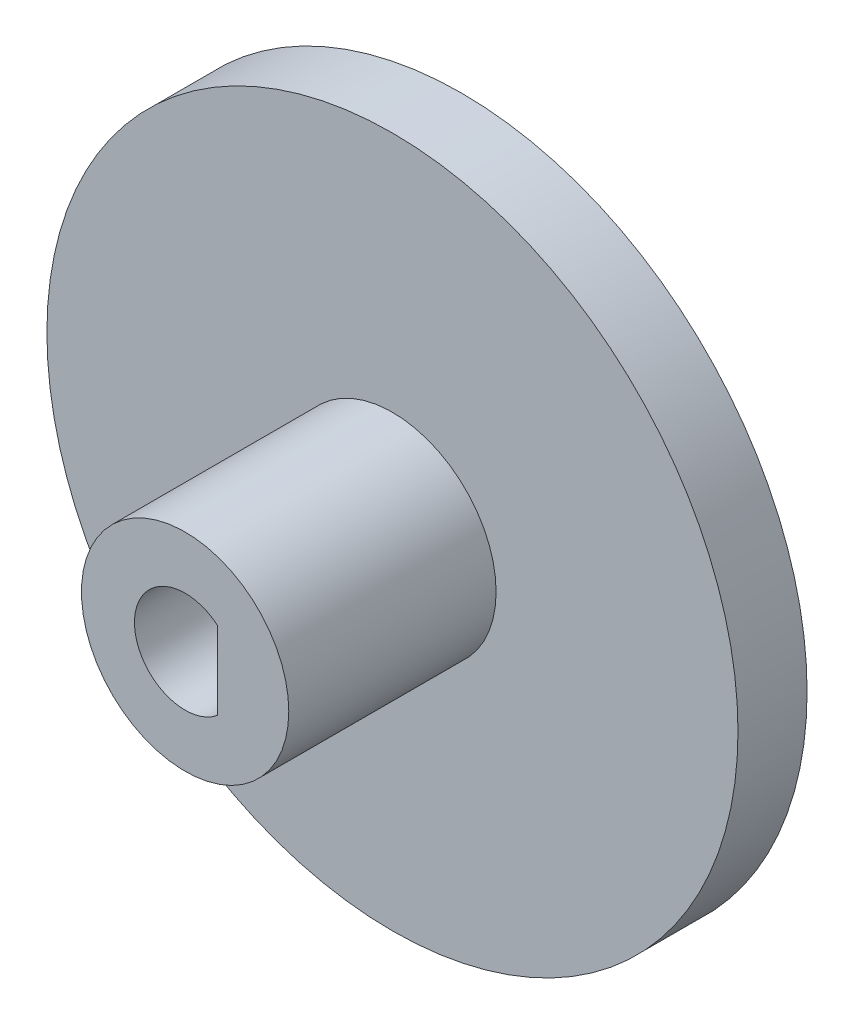
from build123d import *

# Parameters (mm, degrees)
SKETCH_2_R          = 4.5
EXTRUDE_1_DEPTH     = 9
SKETCH_3_R          = 15
EXTRUDE_2_DEPTH     = 3
CUT_EXTRUDE_1_DEPTH = 10


with BuildPart() as part:
    # Эскиз2 → Бобышка-Вытянуть1 (new body)
    with BuildSketch(Plane.XY):
        Circle(SKETCH_2_R)
    extrude(amount=EXTRUDE_1_DEPTH)

    # Эскиз3 → Бобышка-Вытянуть2 (add)
    with BuildSketch(Plane.XY):
        Circle(SKETCH_3_R)
    extrude(amount=-EXTRUDE_2_DEPTH)

    # Эскиз1 → Вырез-Вытянуть1 (cut)
    with BuildSketch(Plane.XY):
        with BuildLine():
            Line((1.4, 1.697056275), (1.4, -1.697056275))
            ThreePointArc((1.4, -1.697056275), (-2.2, 0), (1.4, 1.697056275))
        make_face()
    extrude(amount=CUT_EXTRUDE_1_DEPTH, mode=Mode.SUBTRACT)


solid = part.part
